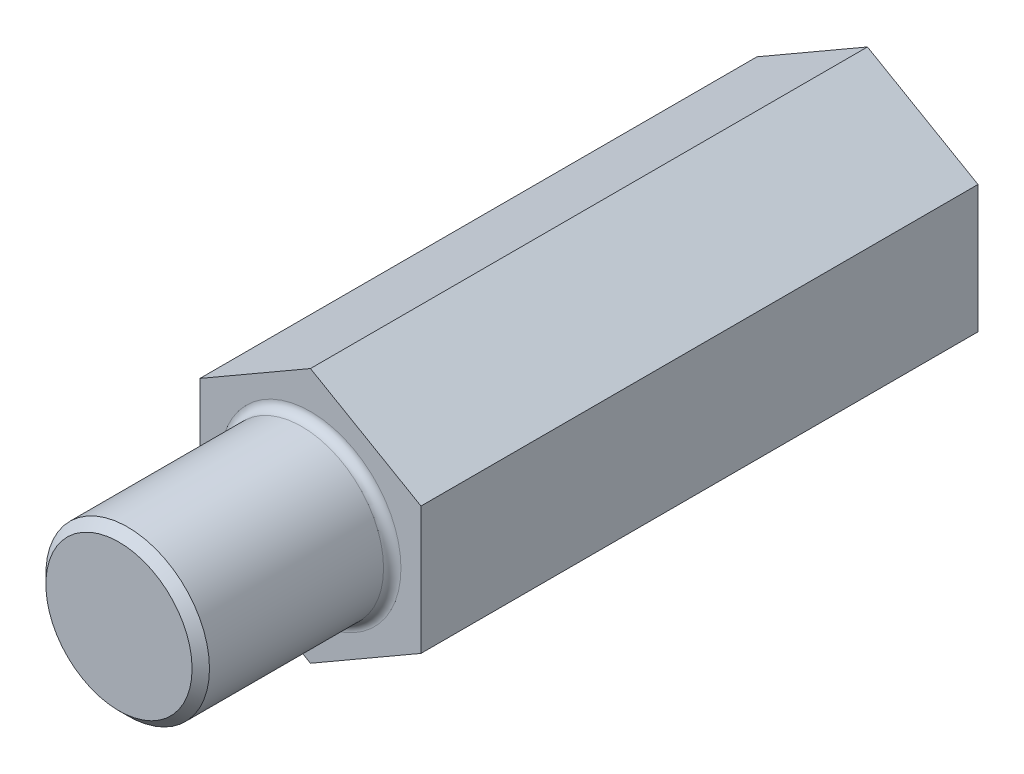
from build123d import *

# Parameters (mm, degrees)
BOSS_EXTRUDE1_DEPTH       = 43
SKETCH4_R                 = 10.207731482
SKETCH4_R_2               = 4.7
CUT_EXTRUDE3_DEPTH        = 11
CHAMFER3_SIZE             = 0.5
FILLET2_R                 = 0.5
F_1_0MM_DOWEL_HOLE1_D     = 6.35
F_1_0MM_DOWEL_HOLE1_DEPTH = 13
F_1_0MM_DOWEL_HOLE1_TIP   = 1.907732465
CHAMFER4_SIZE             = 0.5


with BuildPart() as part:
    # Sketch1 → Boss-Extrude1 (new body)
    with BuildSketch(Plane.XY):
        Polygon((0, 7.332348419), (-6.35, 3.666174209), (-6.35, -3.666174209), (0, -7.332348419), (6.35, -3.666174209), (6.35, 3.666174209), align=None)
    extrude(amount=BOSS_EXTRUDE1_DEPTH)

    # Sketch4 → Cut-Extrude3 (cut)
    with BuildSketch(Plane.XY.offset(43)):
        Circle(SKETCH4_R)
        Circle(SKETCH4_R_2, mode=Mode.SUBTRACT)
    extrude(amount=-CUT_EXTRUDE3_DEPTH, mode=Mode.SUBTRACT)

    # Chamfer3
    chamfer3_edges = [part.edges().sort_by_distance(p)[0] for p in [
        (-4.7, 0, 43),
    ]]
    chamfer(chamfer3_edges, length=CHAMFER3_SIZE)

    # Fillet2
    fillet2_edges = [part.edges().sort_by_distance(p)[0] for p in [
        (-4.7, 0, 32),
    ]]
    fillet(fillet2_edges, radius=FILLET2_R)

    # Ø1.0mm Dowel Hole1
    with Locations(Plane(origin=(0, 0, 0), x_dir=(-1, 0, 0), z_dir=(0, 0, -1))):
        with Locations((0, 0)):
            Hole(F_1_0MM_DOWEL_HOLE1_D / 2, depth=F_1_0MM_DOWEL_HOLE1_DEPTH)
            with Locations((0, 0, -(F_1_0MM_DOWEL_HOLE1_DEPTH + F_1_0MM_DOWEL_HOLE1_TIP / 2))):  # 118° drill point
                Cone(0, F_1_0MM_DOWEL_HOLE1_D / 2, F_1_0MM_DOWEL_HOLE1_TIP, mode=Mode.SUBTRACT)

    # Chamfer4
    chamfer4_edges = [part.edges().sort_by_distance(p)[0] for p in [
        (-3.175, 0, 0),
    ]]
    chamfer(chamfer4_edges, length=CHAMFER4_SIZE)


solid = part.part
